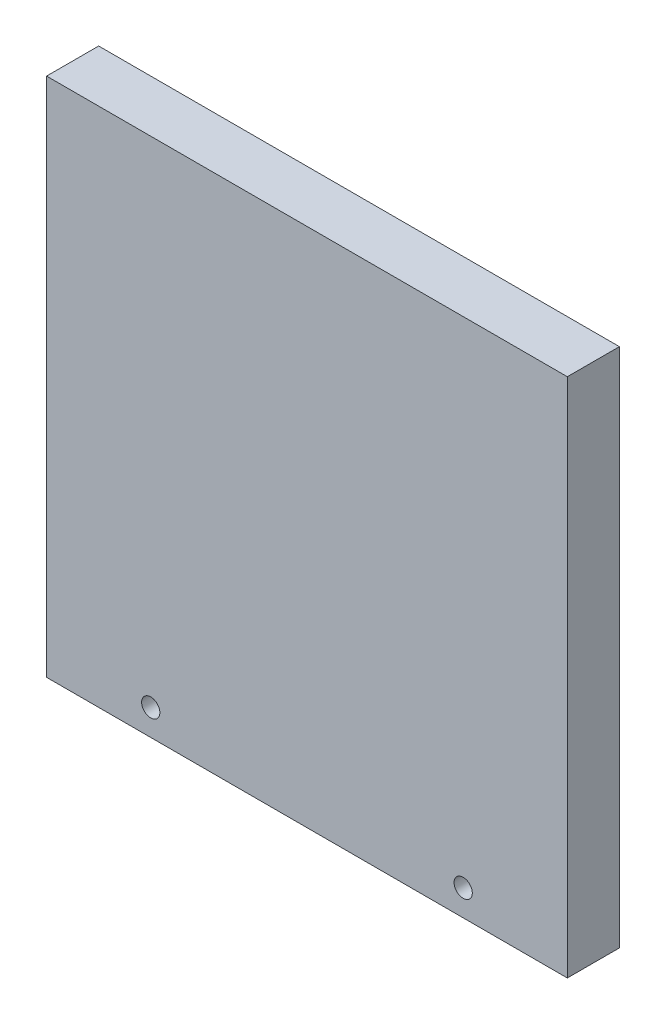
from build123d import *

# Parameters (mm, degrees)
SKETCH1_W           = 100
SKETCH1_H           = 100
SKETCH1_R           = 1.75
BOSS_EXTRUDE1_DEPTH = 10
BOSS_EXTRUDE2_DEPTH = 4


with BuildPart() as part:
    # Sketch1 → Boss-Extrude1 (new body)
    with BuildSketch(Plane.XY):
        with Locations((-126.253776435, 13.202416918)):
            Rectangle(SKETCH1_W, SKETCH1_H)
        with Locations((-156.253776435, -31.797583082)):
            Circle(SKETCH1_R, mode=Mode.SUBTRACT)
        with Locations((-96.253776435, -31.797583082)):
            Circle(SKETCH1_R, mode=Mode.SUBTRACT)
    extrude(amount=BOSS_EXTRUDE1_DEPTH)

    # Sketch2 → Boss-Extrude2 (add, symmetric)
    with BuildSketch(Plane(origin=(0, 13.202416918, 0), x_dir=(1, 0, 0), z_dir=(0, 1, 0))):
        with BuildLine():
            ThreePointArc((-76.253776435, 0), (-97.691099578, 5.937794762), (-113.018482317, 22.058823529))
            ThreePointArc((-113.018482317, 22.058823529), (-126.253776435, 30), (-139.489070553, 22.058823529))
            ThreePointArc((-139.489070553, 22.058823529), (-154.816453292, 5.937794762), (-176.253776435, 0))
            Line((-176.253776435, 0), (-76.253776435, 0))
        make_face()
        with BuildLine():
            Line((-131.753776435, 24.526279442), (-126.253776435, 27.701705922))
            Line((-126.253776435, 27.701705922), (-120.753776435, 24.526279442))
            ThreePointArc((-120.753776435, 24.526279442), (-126.253776435, 4), (-131.753776435, 24.526279442))
        make_face(mode=Mode.SUBTRACT)
    extrude(amount=BOSS_EXTRUDE2_DEPTH, both=True)


solid = part.part
